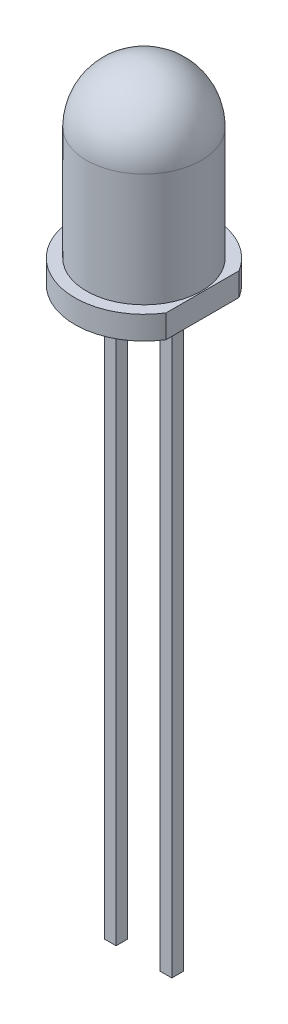
from build123d import *

# Parameters (mm, degrees)
BOSS_EXTRUDE1_DEPTH = 1
SKETCH5_W           = 0.5
SKETCH5_H           = 0.5
BOSS_EXTRUDE2_DEPTH = 25


with BuildPart() as part:
    # Sketch1 → Boss-Extrude1 (new body)
    with BuildSketch(Plane(origin=(0, 0, 0), x_dir=(1, 0, 0), z_dir=(0, 1, 0))):
        with BuildLine():
            Line((2.525, -1.573213272), (2.525, 1.573213272))
            ThreePointArc((2.525, 1.573213272), (-2.975, 0), (2.525, -1.573213272))
        make_face()
    extrude(amount=BOSS_EXTRUDE1_DEPTH)

    # Sketch4 → Revolve1 (revolve)
    with BuildSketch(Plane.XY):
        with BuildLine():
            Line((-2.475, 1), (-2.475, 5.875))
            ThreePointArc((-2.475, 5.875), (-1.750089283, 7.625089283), (0, 8.35))
            Line((0, 8.35), (0, 1))
            Line((0, 1), (-2.475, 1))
        make_face()
    revolve(axis=Axis((0, 0, 0), (0, 1, 0)))

    # Sketch5 → Boss-Extrude2 (add)
    with BuildSketch(Plane(origin=(0, 0, 0), x_dir=(-1, 0, 0), z_dir=(0, -1, 0))):
        with Locations((-1.2, 0)):
            Rectangle(SKETCH5_W, SKETCH5_H)
        with Locations((1.2, 0)):
            Rectangle(SKETCH5_W, SKETCH5_H)
    extrude(amount=BOSS_EXTRUDE2_DEPTH)


solid = part.part
